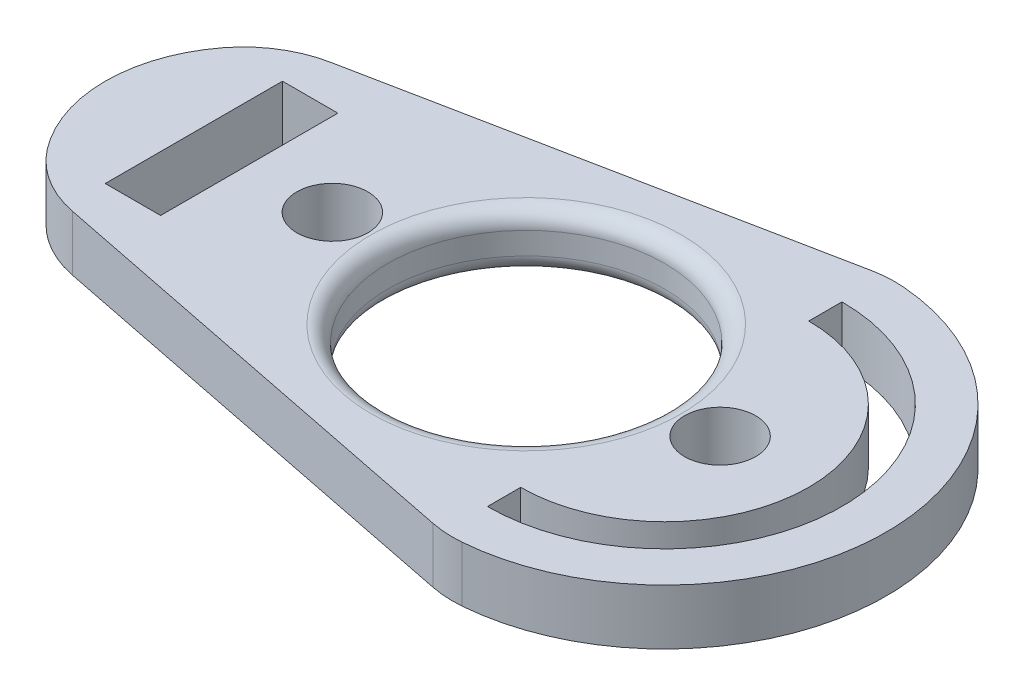
from build123d import *

# Parameters (mm, degrees)
SKETCH1_R           = 0.32069999999999993
SKETCH1_W           = 0.49999999999999956
SKETCH1_H           = 1.6
SKETCH1_R_2         = 0.3207000000000001
BOSS_EXTRUDE1_DEPTH = 0.5
FILLET3_R           = 0.15


with BuildPart() as part:
    # Sketch1 → Boss-Extrude1 (new body)
    # profile 1 of 2: a face of its own
    with BuildSketch(Plane(origin=(0, 0, 0), x_dir=(1, 0, 0), z_dir=(0, 1, 0))):
        with BuildLine():
            ThreePointArc((0.16410089999999872, 1.9932563547231181), (0.02454856527933624, 1.9949735752626254), (-0.11388375906019726, 1.9772452208459481))
            Line((-0.11388375906019724, 1.9772452208459481), (-1.2499999999996807, 1.7502411741825006))
            Line((-1.2499999999996807, 1.7502411741825006), (-1.2499999999996807, 1.2499999999996991))
            ThreePointArc((-1.2499999999996807, 1.2499999999996991), (-0.3661165235167134, 0.8838834764829733), (1.221e-14, 6.11e-15))
            ThreePointArc((1.221e-14, 5.8e-15), (-0.36611652351671364, -0.8838834764829614), (-1.249999999999681, -1.2499999999996867))
            Line((-1.2499999999996807, -1.249999999999687), (-1.2499999999996805, -1.7502411741825006))
            Line((-1.2499999999996805, -1.7502411741825006), (-0.11388375997143456, -1.9772452206638764))
            ThreePointArc((-0.11388375997143454, -1.9772452206638764), (0.02454856391169549, -1.9949735750542663), (0.16410089817752455, -1.9932563546160664))
            ThreePointArc((0.16410089817752457, -1.9932563546160669), (2.0000000001183995, -7.8577381e-10), (0.16410089999999872, 1.9932563547231181))
        make_face()
        with Locations(Location((0.5, 0, 0), (0, 0, 270))):
            Circle(SKETCH1_R, mode=Mode.SUBTRACT)
        with BuildLine():
            Line((-1.058207e-11, 1.3000000001285459), (-1.058197e-11, 1.6000000001285462))
            ThreePointArc((-1.058197e-11, 1.6000000001285457), (1.5999999999894177, 1.2854606e-10), (-1.058164e-11, -1.599999999871454))
            Line((-1.058197e-11, -1.599999999871454), (-1.058207e-11, -1.299999999871454))
            ThreePointArc((-1.058171e-11, -1.299999999871454), (1.2999999999894176, 1.2854607e-10), (-1.058207e-11, 1.3000000001285457))
        make_face(mode=Mode.SUBTRACT)
    # profile 2 of 2: a face of its own
    with BuildSketch(Plane(origin=(0, 0, 0), x_dir=(1, 0, 0), z_dir=(0, 1, 0))):
        with BuildLine():
            Line((-1.2499999999996807, 1.2499999999996991), (-1.2499999999996807, 1.7502411741825006))
            Line((-1.2499999999996807, 1.7502411741825006), (-4.1832356905240005, 1.1641599726532808))
            ThreePointArc((-4.1832356905240005, 1.1641599726532808), (-4.514100230865791, 1.0335329749029736), (-4.778306419676481, 0.7953526936222303))
            ThreePointArc((-4.778306419676481, 0.7953526936222305), (-5.05, -4.7e-16), (-4.778306419676481, -0.7953526936222314))
            ThreePointArc((-4.778306419676481, -0.7953526936222312), (-4.514100230865791, -1.033532974902974), (-4.1832356905240005, -1.1641599726532812))
            Line((-4.1832356905240005, -1.164159972653281), (-1.2499999999996805, -1.7502411741825006))
            Line((-1.2499999999996805, -1.7502411741825006), (-1.2499999999996807, -1.249999999999687))
            ThreePointArc((-1.249999999999681, -1.2499999999996867), (-2.499999999999374, 6.26e-15), (-1.2499999999996807, 1.2499999999996991))
        make_face()
        with Locations((-4, 0)):
            Rectangle(SKETCH1_W, SKETCH1_H, mode=Mode.SUBTRACT)
        with Locations(Location((-3, 0, 0), (0, 0, 270))):
            Circle(SKETCH1_R_2, mode=Mode.SUBTRACT)
    extrude(amount=BOSS_EXTRUDE1_DEPTH)

    # Fillet3
    fillet3_edges = [part.edges().sort_by_distance(p)[0] for p in [
        (-1.2499999999996816, 0, 1.2499999999996865),
        (-1.2499999999996807, 0.5, 1.249999999999687),
    ]]
    fillet(fillet3_edges, radius=FILLET3_R)


solid = part.part
